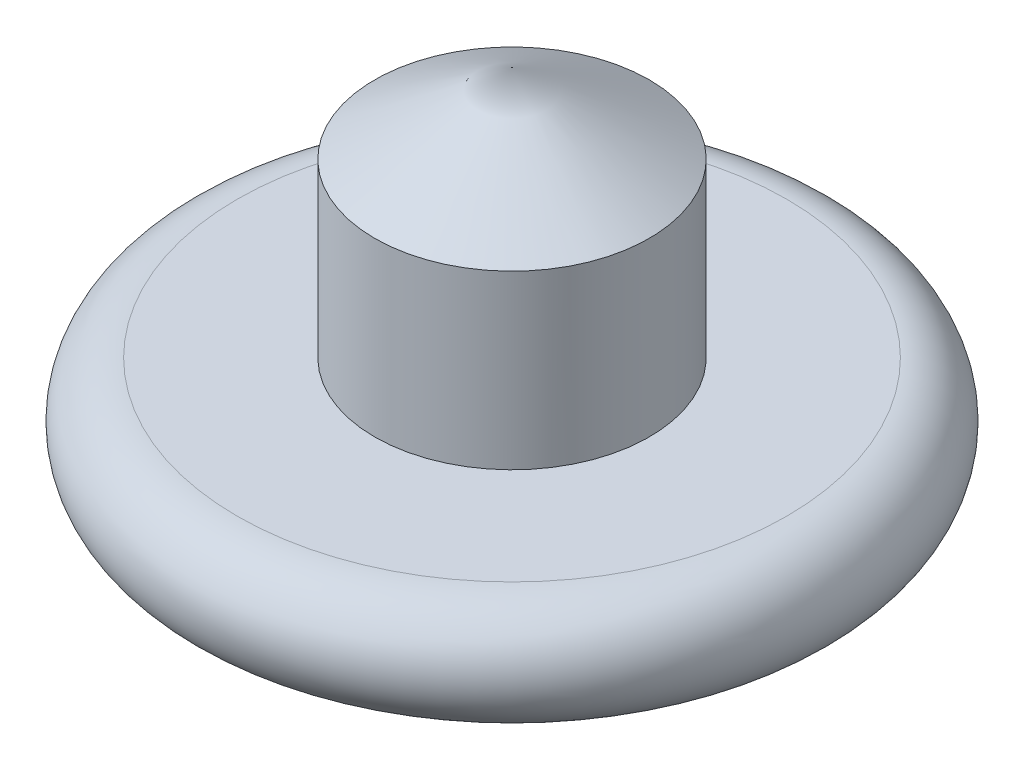
from build123d import *


with BuildPart() as part:
    # Sketch1 → Revolve8 (revolve)
    with BuildSketch(Plane.XY, mode=Mode.PRIVATE) as revolve8_sk:
        with BuildLine():
            Line((0, 0), (100, 0))
            ThreePointArc((100, 0), (120, 20), (100, 40))
            Line((100, 40), (50, 40))
            Line((50, 40), (50, 102.627096316))
            Line((50, 102.627096316), (0, 131.494609776))
            Line((0, 131.494609776), (0, 0))
        make_face()
    revolve(revolve8_sk.sketch.rotate(Axis((0, 131.494609776, 0), (0, -1, 0)), 90), axis=Axis((0, 131.494609776, 0), (0, -1, 0)))


solid = part.part
